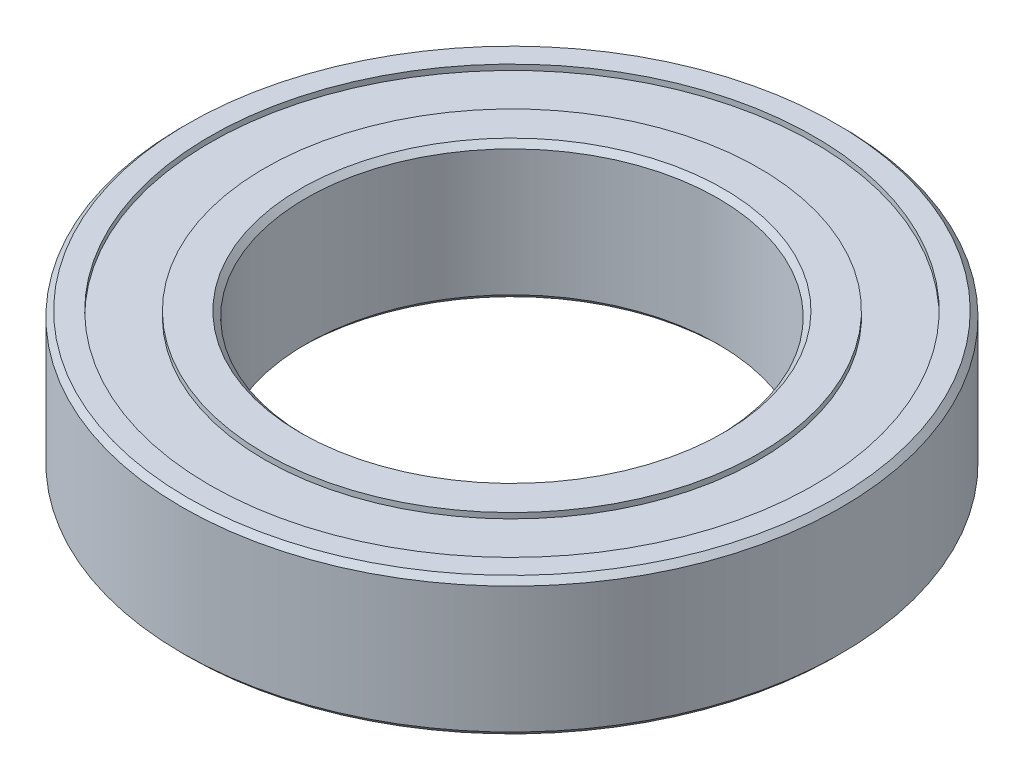
from build123d import *

# Parameters (mm, degrees)
SKETCH1_R           = 12
SKETCH1_R_2         = 7.5
BOSS_EXTRUDE1_DEPTH = 5
SKETCH2_R           = 11
SKETCH2_R_2         = 9
CUT_EXTRUDE1_DEPTH  = 0.2
CUT_EXTRUDE2_START  = -0.2
SKETCH3_R           = 11
SKETCH3_R_2         = 9
CUT_EXTRUDE2_DEPTH  = 0.2
CHAMFER1_SIZE       = 0.2


with BuildPart() as part:
    # Sketch1 → Boss-Extrude1 (new body)
    with BuildSketch(Plane(origin=(0, 0, 0), x_dir=(1, 0, 0), z_dir=(0, 1, 0))):
        with Locations(Location((0, 0, 0), (0, 0, 270))):
            Circle(SKETCH1_R)
        with Locations(Location((0, 0, 0), (0, 0, 270))):
            Circle(SKETCH1_R_2, mode=Mode.SUBTRACT)
    extrude(amount=BOSS_EXTRUDE1_DEPTH)

    # Sketch2 → Cut-Extrude1 (cut)
    with BuildSketch(Plane(origin=(0, 5, 0), x_dir=(1, 0, 0), z_dir=(0, 1, 0))):
        with Locations(Location((0, 0, 0), (0, 0, 270))):
            Circle(SKETCH2_R)
        with Locations(Location((0, 0, 0), (0, 0, 270))):
            Circle(SKETCH2_R_2, mode=Mode.SUBTRACT)
    extrude(amount=-CUT_EXTRUDE1_DEPTH, mode=Mode.SUBTRACT)

    # Sketch3 → Cut-Extrude2 (cut)
    with BuildSketch(Plane.XZ.offset(CUT_EXTRUDE2_START)):
        with Locations(Location((0, 0, 0), (0, 0, 90))):
            Circle(SKETCH3_R)
        with Locations(Location((0, 0, 0), (0, 0, 90))):
            Circle(SKETCH3_R_2, mode=Mode.SUBTRACT)
    extrude(amount=CUT_EXTRUDE2_DEPTH, mode=Mode.SUBTRACT)

    # Chamfer1
    chamfer1_edges = [part.edges().sort_by_distance(p)[0] for p in [
        (0, 0, -12),
        (0, 5, -12),
        (0, 0, -7.5),
        (0, 5, -7.5),
    ]]
    chamfer(chamfer1_edges, length=CHAMFER1_SIZE)


solid = part.part
